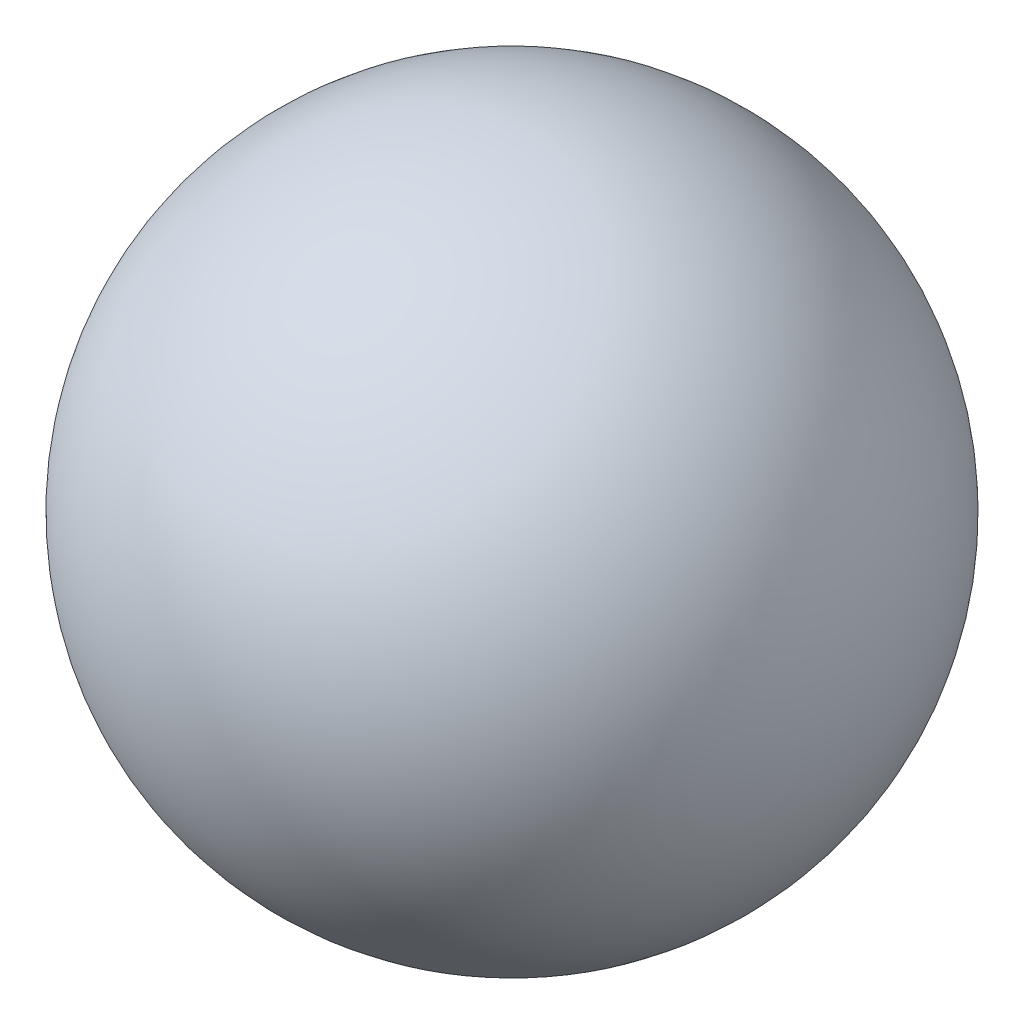
from build123d import *

# Parameters (mm, degrees)
SKETCH3_R          = 3
CUT_EXTRUDE1_DEPTH = 17


with BuildPart() as part:
    # Sketch2 → Revolve8 (revolve)
    with BuildSketch(Plane.XY):
        with BuildLine():
            Line((0, 25.099393897), (0, 30.198787793))
            ThreePointArc((0, 30.198787793), (-15.099393897, 15.099393897), (0, 0))
            Line((0, 0), (0, 5.099393897))
            ThreePointArc((0, 5.099393897), (-10, 15.099393897), (0, 25.099393897))
        make_face()
    revolve(axis=Axis((0, 0, 0), (0, 1, 0)))

    # Sketch3 → Cut-Extrude1 (cut)
    with BuildSketch(Plane(origin=(0, 0, 0), x_dir=(1, 0, 0), z_dir=(0, 1, 0))):
        Circle(SKETCH3_R)
    extrude(amount=CUT_EXTRUDE1_DEPTH, mode=Mode.SUBTRACT)


solid = part.part
